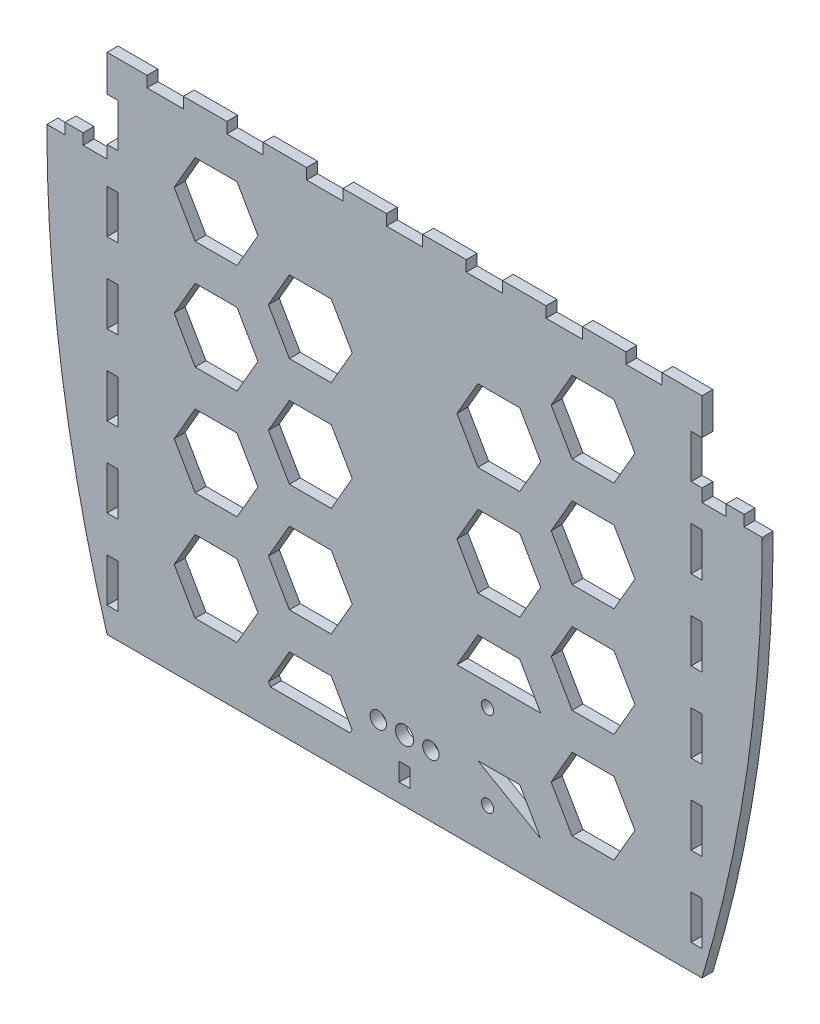
from build123d import *

# Parameters (mm, degrees)
BOSS_EXTRUDE1_DEPTH = 3
SKETCH2_W           = 10
SKETCH2_H           = 3
SKETCH2_W_2         = 3
SKETCH2_H_2         = 12
CUT_EXTRUDE1_DEPTH  = 10
SKETCH5_R           = 1.7
SKETCH5_W           = 3
SKETCH5_H           = 5
CUT_EXTRUDE2_DEPTH  = 3
SKETCH6_R           = 2.5
SKETCH6_R_2         = 2.25
CUT_EXTRUDE3_DEPTH  = 10


with BuildPart() as part:
    # Sketch1 → Boss-Extrude1 (new body)
    with BuildSketch(Plane.XY.offset(152)):
        with BuildLine():
            Line((-82, 69.5), (82, 69.5))
            Line((82, 69.5), (82, 44))
            Line((82, 44), (88.6, 44))
            Line((88.6, 44), (88.6, 47))
            Line((88.6, 47), (93.6, 47))
            Line((93.6, 47), (93.6, 44))
            Line((93.6, 44), (98.6, 44))
            Line((98.6, 44), (98.6, 43.377104502))
            ThreePointArc((98.6, 43.377104502), (94.427800977, -13.668492876), (82, -69.5))
            Line((82, -69.5), (-82, -69.5))
            ThreePointArc((-82, -69.5), (-94.427800977, -13.668492876), (-98.6, 43.377104502))
            Line((-98.6, 43.377104502), (-98.6, 44))
            Line((-98.6, 44), (-93.6, 44))
            Line((-93.6, 44), (-93.6, 47))
            Line((-93.6, 47), (-88.6, 47))
            Line((-88.6, 47), (-88.6, 44))
            Line((-88.6, 44), (-82, 44))
            Line((-82, 44), (-82, 69.5))
        make_face()
    extrude(amount=BOSS_EXTRUDE1_DEPTH)

    # Sketch2 → Cut-Extrude1 (cut)
    with BuildSketch(Plane.XY.offset(155)):
        with Locations((0, 68)):
            Rectangle(SKETCH2_W, SKETCH2_H)
        with Locations((-22, 68)):
            Rectangle(SKETCH2_W, SKETCH2_H)
        with Locations((22, 68)):
            Rectangle(SKETCH2_W, SKETCH2_H)
        with Locations((-44, 68)):
            Rectangle(SKETCH2_W, SKETCH2_H)
        with Locations((44, 68)):
            Rectangle(SKETCH2_W, SKETCH2_H)
        with Locations((-66, 68)):
            Rectangle(SKETCH2_W, SKETCH2_H)
        with Locations((66, 68)):
            Rectangle(SKETCH2_W, SKETCH2_H)
        with Locations((-80.5, 53.5)):
            Rectangle(SKETCH2_W_2, SKETCH2_H_2)
        with Locations((80.5, 53.5)):
            Rectangle(SKETCH2_W_2, SKETCH2_H_2)
        with Locations((-80.5, 31.5)):
            Rectangle(SKETCH2_W_2, SKETCH2_H_2)
        with Locations((-80.5, 9.5)):
            Rectangle(SKETCH2_W_2, SKETCH2_H_2)
        with Locations((-80.5, -12.5)):
            Rectangle(SKETCH2_W_2, SKETCH2_H_2)
        with Locations((-80.5, -34.5)):
            Rectangle(SKETCH2_W_2, SKETCH2_H_2)
        with Locations((-80.5, -56.5)):
            Rectangle(SKETCH2_W_2, SKETCH2_H_2)
        with Locations((80.5, -56.5)):
            Rectangle(SKETCH2_W_2, SKETCH2_H_2)
        with Locations((80.5, -34.5)):
            Rectangle(SKETCH2_W_2, SKETCH2_H_2)
        with Locations((80.5, -12.5)):
            Rectangle(SKETCH2_W_2, SKETCH2_H_2)
        with Locations((80.5, 9.5)):
            Rectangle(SKETCH2_W_2, SKETCH2_H_2)
        with Locations((80.5, 31.5)):
            Rectangle(SKETCH2_W_2, SKETCH2_H_2)
    extrude(amount=-CUT_EXTRUDE1_DEPTH, mode=Mode.SUBTRACT)

    # Sketch5 → Cut-Extrude2 (cut)
    with BuildSketch(Plane.XY.offset(155)):
        with Locations((22.86677044, -57.9)):
            Circle(SKETCH5_R)
        with Locations((22.86677044, -34.5)):
            Circle(SKETCH5_R)
        Polygon((63.508529611, 46.5), (57.735026919, 56.5), (46.188021535, 56.5), (40.414518843, 46.5), (46.188021535, 36.5), (57.735026919, 36.5), align=None)
        Polygon((31.754264805, 41.5), (20.207259422, 41.5), (14.43375673, 31.5), (20.207259422, 21.5), (31.754264805, 21.5), (37.527767497, 31.5), align=None)
        Polygon((-20.207259422, 41.5), (-31.754264805, 41.5), (-37.527767497, 31.5), (-31.754264805, 21.5), (-20.207259422, 21.5), (-14.43375673, 31.5), align=None)
        Polygon((-20.207259422, 11.5), (-31.754264805, 11.5), (-37.527767497, 1.5), (-31.754264805, -8.5), (-20.207259422, -8.5), (-14.43375673, 1.5), align=None)
        Polygon((31.754264805, 11.5), (20.207259422, 11.5), (14.43375673, 1.5), (20.207259422, -8.5), (31.754264805, -8.5), (37.527767497, 1.5), align=None)
        Polygon((63.508529611, 16.5), (57.735026919, 26.5), (46.188021535, 26.5), (40.414518843, 16.5), (46.188021535, 6.5), (57.735026919, 6.5), align=None)
        Polygon((-20.207259422, -18.5), (-31.754264805, -18.5), (-37.527767497, -28.5), (-31.754264805, -38.5), (-20.207259422, -38.5), (-14.43375673, -28.5), align=None)
        Polygon((31.754264805, -18.5), (20.207259422, -18.5), (14.43375673, -28.5), (37.527767497, -28.5), align=None)
        Polygon((63.508529611, -13.5), (57.735026919, -3.5), (46.188021535, -3.5), (40.414518843, -13.5), (46.188021535, -23.5), (57.735026919, -23.5), align=None)
        Polygon((-20.207259422, -48.5), (-31.754264805, -48.5), (-37.527767497, -58.5), (-36.950417228, -59.5), (-15.011106999, -59.5), (-14.43375673, -58.5), align=None)
        Polygon((31.754264805, -48.5), (20.207259422, -48.5), (37.527767497, -58.5), align=None)
        Polygon((63.508529611, -43.5), (57.735026919, -33.5), (46.188021535, -33.5), (40.414518843, -43.5), (46.188021535, -53.5), (57.735026919, -53.5), align=None)
        Polygon((-40.412994616, 46.5), (-46.186497308, 56.5), (-57.733502692, 56.5), (-63.507005384, 46.5), (-57.733502692, 36.5), (-46.186497308, 36.5), align=None)
        Polygon((-40.412994616, 16.5), (-46.186497308, 26.5), (-57.733502692, 26.5), (-63.507005384, 16.5), (-57.733502692, 6.5), (-46.186497308, 6.5), align=None)
        Polygon((-40.412994616, -13.5), (-46.186497308, -3.5), (-57.733502692, -3.5), (-63.507005384, -13.5), (-57.733502692, -23.5), (-46.186497308, -23.5), align=None)
        Polygon((-40.412994616, -43.5), (-46.186497308, -33.5), (-57.733502692, -33.5), (-63.507005384, -43.5), (-57.733502692, -53.5), (-46.186497308, -53.5), align=None)
        with Locations((0, -62)):
            Rectangle(SKETCH5_W, SKETCH5_H)
    extrude(amount=-CUT_EXTRUDE2_DEPTH, mode=Mode.SUBTRACT)

    # Sketch6 → Cut-Extrude3 (cut)
    with BuildSketch(Plane.XY.offset(155)):
        with Locations((0, -52.5)):
            Circle(SKETCH6_R)
        with Locations((-7.25, -52.5)):
            Circle(SKETCH6_R_2)
        with Locations((7.25, -52.5)):
            Circle(SKETCH6_R_2)
    extrude(amount=-CUT_EXTRUDE3_DEPTH, mode=Mode.SUBTRACT)


solid = part.part
